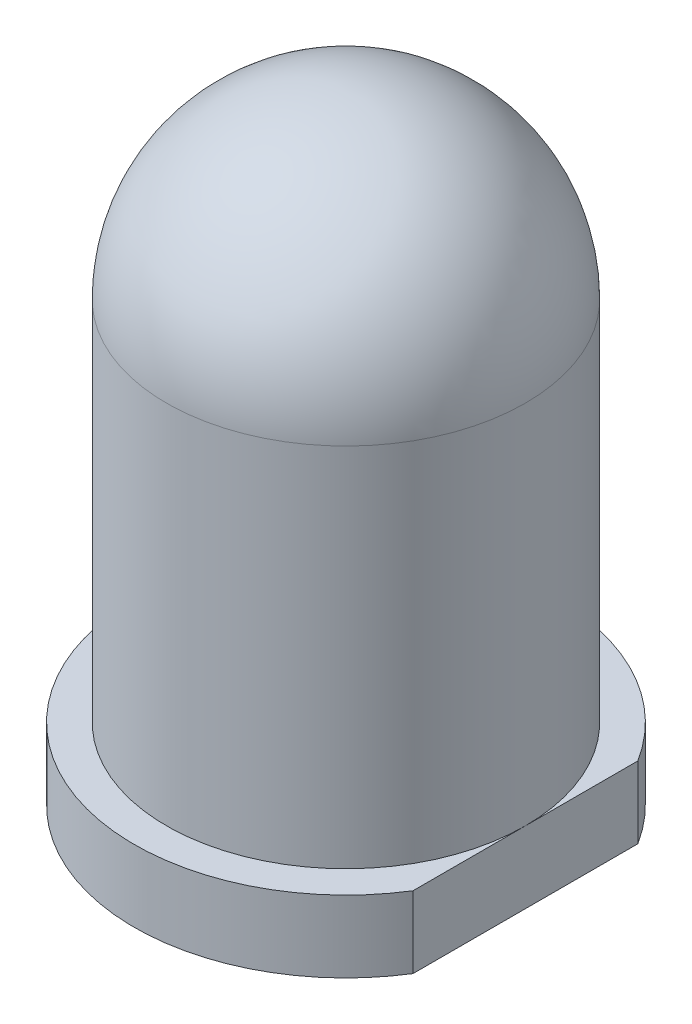
from build123d import *

# Parameters (mm, degrees)
ENL_V_MAT_EXTRU_1_DEPTH = 10.558504067


with BuildPart() as part:
    # Esquisse1 → Révolution1 (revolve)
    with BuildSketch(Plane.XY, mode=Mode.PRIVATE) as r_volution1_sk:
        with BuildLine():
            Line((0, 0), (2.95, 0))
            Line((2.95, 0), (2.95, 1))
            Line((2.95, 1), (2.5, 1))
            Line((2.5, 1), (2.5, 6.1))
            ThreePointArc((2.5, 6.1), (1.767766953, 7.867766953), (0, 8.6))
            Line((0, 8.6), (0, 0))
        make_face()
    revolve(r_volution1_sk.sketch.rotate(Axis((0, -2.358049411, 0), (0, 1, 0)), 90), axis=Axis((0, -2.358049411, 0), (0, 1, 0)))

    # Esquisse2 → Enlèv. mat.-Extru.1 (cut, through all)
    with BuildSketch(Plane(origin=(0, 0, 0), x_dir=(1, 0, 0), z_dir=(0, 1, 0))):
        with BuildLine():
            Line((2.5, -1.566045976), (2.5, 1.566045976))
            ThreePointArc((2.5, 1.566045976), (2.95, 0), (2.5, -1.566045976))
        make_face()
    extrude(amount=ENL_V_MAT_EXTRU_1_DEPTH, mode=Mode.SUBTRACT)


solid = part.part
